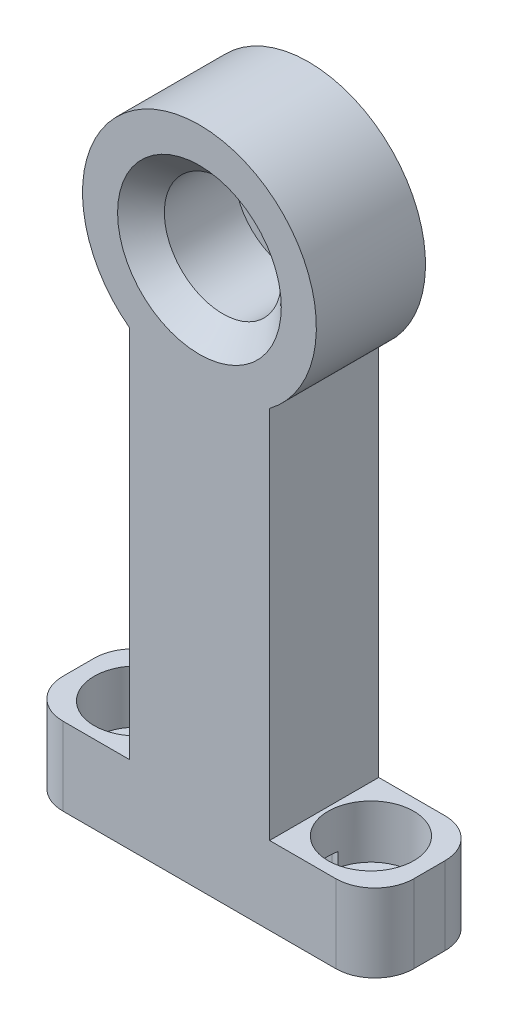
from build123d import *

# Parameters (mm, degrees)
SKETCH_1_R                = 15
SKETCH_1_R_2              = 0.5
EXTRUDE_1_DEPTH           = 7
CUT_EXTRUDE_START         = -12
SKETCH_2_R                = 7.5
SKETCH_2_R_2              = 0.5
CUT_EXTRUDE_1_DEPTH       = 12
CHAMFER_1_SIZE            = 3
EXTRUDE_2_DEPTH           = 7
CUT_EXTRUDE_2_DEPTH       = 5
FILLET_1_R                = 5
MM_1_D                    = 4
MM_1_DEPTH                = 5
MM_1_TIP                  = 1.201721238
HOLE_WIZARD_1_D           = 6.4
HOLE_WIZARD_1_DEPTH       = 10
HOLE_WIZARD_1_CBORE_D     = 11
HOLE_WIZARD_1_CBORE_DEPTH = 6.8


with BuildPart() as part:
    # 草图1 → 凸台-拉伸1 (new, symmetric)
    with BuildSketch(Plane.XY):
        Circle(SKETCH_1_R)
        Circle(SKETCH_1_R_2, mode=Mode.SUBTRACT)
    extrude(amount=EXTRUDE_1_DEPTH, both=True)

    # 草图2 → 切除-拉伸1 (cut)
    with BuildSketch(Plane.XY.offset(7).offset(CUT_EXTRUDE_START)):
        Circle(SKETCH_2_R)
        Circle(SKETCH_2_R_2, mode=Mode.SUBTRACT)
    extrude(amount=CUT_EXTRUDE_1_DEPTH, mode=Mode.SUBTRACT)

    # 倒角1
    chamfer_1_edges = [part.edges().sort_by_distance(p)[0] for p in [
        (-7.5, 0, 7),
    ]]
    chamfer(chamfer_1_edges, length=CHAMFER_1_SIZE)

    # 草图3 → 凸台-拉伸2 (add, symmetric)
    with BuildSketch(Plane.XY):
        with BuildLine():
            Line((-22.5, -60), (-22.5, -70))
            Line((-22.5, -70), (22.5, -70))
            Line((22.5, -70), (22.5, -60))
            Line((22.5, -60), (9, -60))
            Line((9, -60), (9, -12))
            ThreePointArc((9, -12), (0, -15), (-9, -12))
            Line((-9, -12), (-9, -60))
            Line((-9, -60), (-22.5, -60))
        make_face()
    extrude(amount=EXTRUDE_2_DEPTH, both=True)

    # 草图4 → 切除-拉伸2 (cut)
    with BuildSketch(Plane.XZ.offset(70)):
        with BuildLine():
            Line((6, 2), (8, 2))
            ThreePointArc((8, 2), (10, 0), (8, -2))
            Line((8, -2), (6, -2))
            ThreePointArc((6, -2), (4, 0), (6, 2))
        make_face()
    extrude(amount=-CUT_EXTRUDE_2_DEPTH, mode=Mode.SUBTRACT)

    # 圆角1
    fillet_1_edges = [part.edges().sort_by_distance(p)[0] for p in [
        (-22.5, -65, -7),
        (22.5, -65, 7),
        (-22.5, -65, 7),
        (22.5, -65, -7),
    ]]
    fillet(fillet_1_edges, radius=FILLET_1_R)

    # 大小mm 暗销孔1
    with Locations(Plane(origin=(-7, -70, 0), x_dir=(0, 0, -1), z_dir=(0, -1, 0))):
        with Locations((0, 0)):
            Hole(MM_1_D / 2, depth=MM_1_DEPTH)
            with Locations((0, 0, -(MM_1_DEPTH + MM_1_TIP / 2))):  # 118° drill point
                Cone(0, MM_1_D / 2, MM_1_TIP, mode=Mode.SUBTRACT)

    # 打孔尺寸(%根据)内六角圆柱头螺钉的类型1
    with Locations(Plane(origin=(-15, -60, 0), x_dir=(0, 0, 1), z_dir=(0, 1, 0))):
        with Locations((0, 0), (0, 30)):
            CounterBoreHole(HOLE_WIZARD_1_D / 2, HOLE_WIZARD_1_CBORE_D / 2, HOLE_WIZARD_1_CBORE_DEPTH, depth=HOLE_WIZARD_1_DEPTH)


solid = part.part
